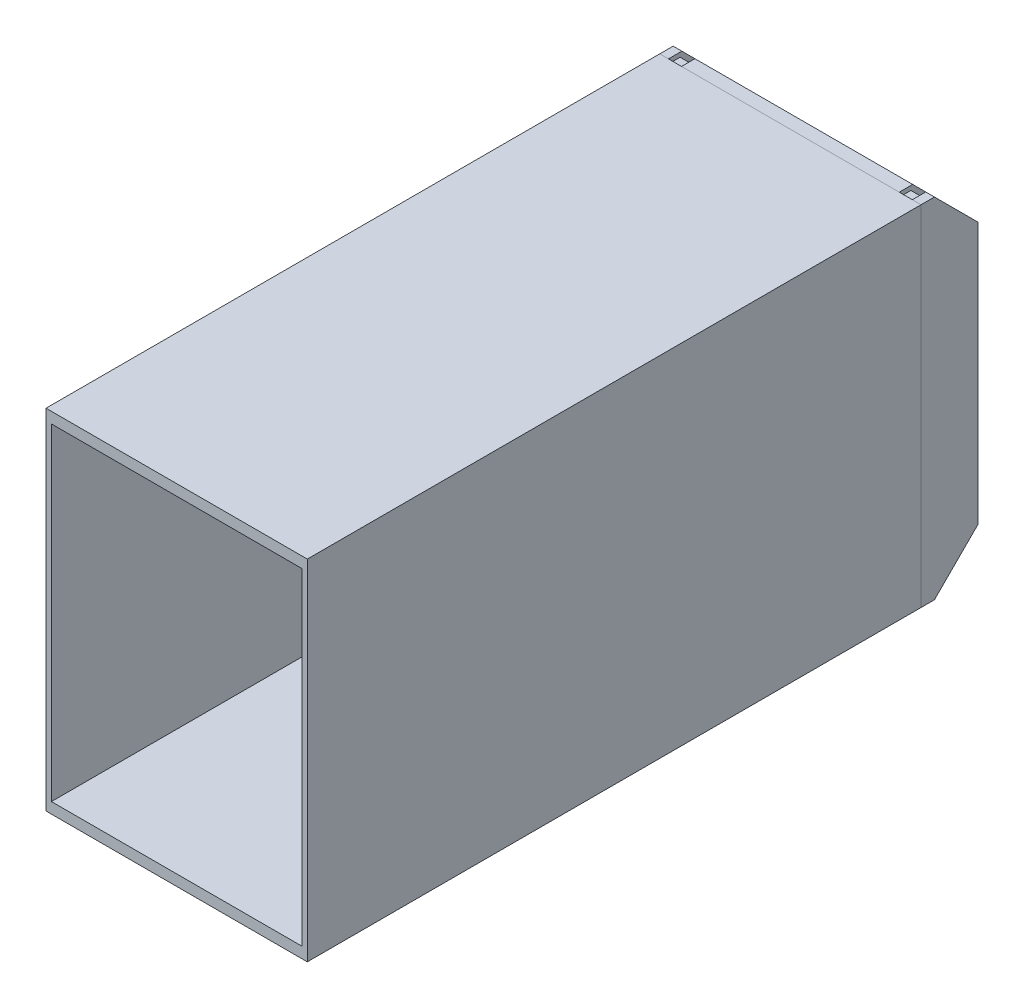
from build123d import *

# Parameters (mm, degrees)
SKETCH1_W               = 600
SKETCH1_H               = 801
BOSS_EXTRUDE1_DEPTH     = 30.8
SKETCH2_W               = 600
SKETCH2_H               = 801
SKETCH2_W_2             = 575.1
SKETCH2_H_2             = 751
BOSS_EXTRUDE2_DEPTH     = 1409.2
SKETCH3_W               = 600
SKETCH3_H               = 601
BOSS_EXTRUDE3_DEPTH     = 100
SKETCH4_W               = 600
SKETCH4_H               = 141.421356237
BOSS_EXTRUDE4_DEPTH     = 100
SKETCH5_W               = 600
SKETCH5_H               = 141.421356237
BOSS_EXTRUDE5_DEPTH     = 100
CUT_EXTRUDE1_DEPTH      = 10
SKETCH7_W               = 30
SKETCH7_H               = 141.421356237
CUT_EXTRUDE2_DEPTH      = 10
CUT_EXTRUDE3_DEPTH      = 10
SKETCH9_W               = 30
SKETCH9_H               = 141.421356237
CUT_EXTRUDE4_DEPTH      = 10
CUT_EXTRUDE5_DEPTH      = 130
CUT_EXTRUDE5_DEPTH_BACK = 130


with BuildPart() as part:
    # Sketch1 → Boss-Extrude1 (new body)
    with BuildSketch(Plane(origin=(0, 0, 0), x_dir=(-1, 0, 0), z_dir=(0, 0, -1))):
        with Locations((0, -124.5)):
            Rectangle(SKETCH1_W, SKETCH1_H)
    extrude(amount=-BOSS_EXTRUDE1_DEPTH)

    # Sketch3 → Boss-Extrude3 (add)
    with BuildSketch(Plane(origin=(0, 0, 0), x_dir=(-1, 0, 0), z_dir=(0, 0, -1))):
        with Locations((0, -124.5)):
            Rectangle(SKETCH3_W, SKETCH3_H)
    extrude(amount=BOSS_EXTRUDE3_DEPTH)

    # Sketch4 → Boss-Extrude4 (add)
    with BuildSketch(Plane(origin=(0, 138, -138), x_dir=(1, 0, 0), z_dir=(0, -0.7071067811865475, 0.7071067811865477))):
        with Locations((0, 124.450793489)):
            Rectangle(SKETCH4_W, SKETCH4_H)
    extrude(amount=BOSS_EXTRUDE4_DEPTH)

    # Sketch5 → Boss-Extrude5 (add)
    with BuildSketch(Plane(origin=(0, -262.5, -262.5), x_dir=(1, 0, 0), z_dir=(0, 0.7071067811865476, 0.7071067811865476))):
        with Locations((0, -300.520382004)):
            Rectangle(SKETCH5_W, SKETCH5_H)
    extrude(amount=BOSS_EXTRUDE5_DEPTH)

    # Sketch6 → Cut-Extrude1 (cut)
    with BuildSketch(Plane.XZ.offset(525)):
        with BuildLine():
            Line((280, 0), (250, 0))
            Line((250, 0), (250, 1345))
            ThreePointArc((250, 1345), (242.67766953, 1362.67766953), (225, 1370))
            Line((225, 1370), (-225, 1370))
            ThreePointArc((-225, 1370), (-242.67766953, 1362.67766953), (-250, 1345))
            Line((-250, 1345), (-250, 0))
            Line((-250, 0), (-280, 0))
            Line((-280, 0), (-280, 1375))
            ThreePointArc((-280, 1375), (-272.67766953, 1392.67766953), (-255, 1400))
            Line((-255, 1400), (255, 1400))
            ThreePointArc((255, 1400), (272.67766953, 1392.67766953), (280, 1375))
            Line((280, 1375), (280, 0))
        make_face()
    extrude(amount=-CUT_EXTRUDE1_DEPTH, mode=Mode.SUBTRACT)

    # Sketch7 → Cut-Extrude2 (cut)
    with BuildSketch(Plane(origin=(0, -262.5, -262.5), x_dir=(1, 0, 0), z_dir=(0, -0.7071067811865477, -0.7071067811865475))):
        with Locations((-265, 300.520382004)):
            Rectangle(SKETCH7_W, SKETCH7_H)
        with Locations((265, 300.520382004)):
            Rectangle(SKETCH7_W, SKETCH7_H)
    extrude(amount=-CUT_EXTRUDE2_DEPTH, mode=Mode.SUBTRACT)

    # Sketch8 → Cut-Extrude3 (cut)
    with BuildSketch(Plane(origin=(0, 276, 0), x_dir=(1, 0, 0), z_dir=(0, 1, 0))):
        with BuildLine():
            Line((-280, 0), (-250, 0))
            Line((-250, 0), (-250, -1345))
            ThreePointArc((-250, -1345), (-242.67766953, -1362.67766953), (-225, -1370))
            Line((-225, -1370), (225, -1370))
            ThreePointArc((225, -1370), (242.67766953, -1362.67766953), (250, -1345))
            Line((250, -1345), (250, 0))
            Line((250, 0), (280, 0))
            Line((280, 0), (280, -1375))
            ThreePointArc((280, -1375), (272.67766953, -1392.67766953), (255, -1400))
            Line((255, -1400), (-255, -1400))
            ThreePointArc((-255, -1400), (-272.67766953, -1392.67766953), (-280, -1375))
            Line((-280, -1375), (-280, 0))
        make_face()
    extrude(amount=-CUT_EXTRUDE3_DEPTH, mode=Mode.SUBTRACT)

    # Sketch9 → Cut-Extrude4 (cut)
    with BuildSketch(Plane(origin=(0, 138, -138), x_dir=(1, 0, 0), z_dir=(0, 0.7071067811865472, -0.7071067811865479))):
        with Locations((-265, -124.450793489)):
            Rectangle(SKETCH9_W, SKETCH9_H)
        with Locations((265, -124.450793489)):
            Rectangle(SKETCH9_W, SKETCH9_H)
    extrude(amount=-CUT_EXTRUDE4_DEPTH, mode=Mode.SUBTRACT)


with BuildPart() as body_2:
    # Sketch2 → Boss-Extrude2 (new body)
    with BuildSketch(Plane.XY.offset(30.8)):
        with Locations((0, -124.5)):
            Rectangle(SKETCH2_W, SKETCH2_H)
        with Locations((0, -124.5)):
            Rectangle(SKETCH2_W_2, SKETCH2_H_2, mode=Mode.SUBTRACT)
    extrude(amount=BOSS_EXTRUDE2_DEPTH)

    # Sketch12 → Cut-Extrude5 (cut, two sides: drawn at the far end of the back side and taken through both)
    with BuildSketch(Plane(origin=(0, 0, 0), x_dir=(0, 0, -1), z_dir=(1, 0, 0)).offset(-CUT_EXTRUDE5_DEPTH_BACK)):
        Polygon((-740, -525), (-340, -525), (-340, -505), align=None)
    extrude(amount=CUT_EXTRUDE5_DEPTH + CUT_EXTRUDE5_DEPTH_BACK, mode=Mode.SUBTRACT)


solid = Compound([part.part, body_2.part])
